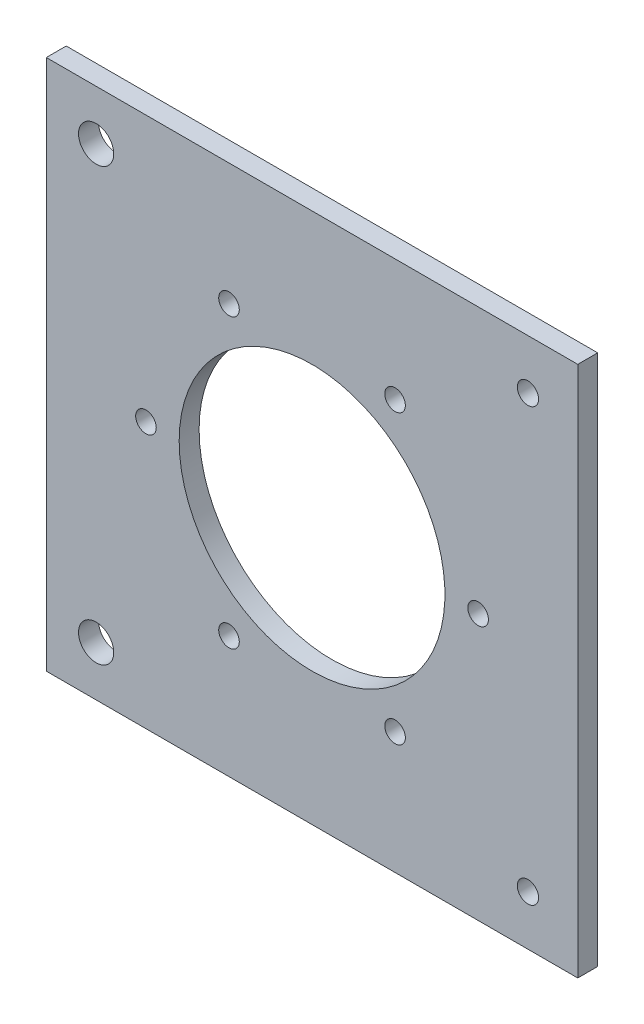
from build123d import *

# Parameters (mm, degrees)
SKETCH_1_W          = 80
SKETCH_1_H          = 80
SKETCH_1_R          = 2.65
SKETCH_1_R_2        = 1.6
SKETCH_1_R_3        = 18
EXTRUDE_1_DEPTH     = 4
SKETCH_2_R          = 1.55
CUT_EXTRUDE_1_DEPTH = 57.709787515
SKETCH_4_R          = 20
CUT_EXTRUDE_2_DEPTH = 57.709787515
SKETCH_5_W          = 141.692074253
SKETCH_5_H          = 118.011672495
CUT_EXTRUDE_3_DEPTH = 1


with BuildPart() as part:
    # 草图1 → 凸台-拉伸1 (new body)
    with BuildSketch(Plane.XY):
        Rectangle(SKETCH_1_W, SKETCH_1_H)
        with Locations((-32.5, 32.5)):
            Circle(SKETCH_1_R, mode=Mode.SUBTRACT)
        with Locations((-32.5, -32.5)):
            Circle(SKETCH_1_R, mode=Mode.SUBTRACT)
        with Locations((32.5, 32.5)):
            Circle(SKETCH_1_R_2, mode=Mode.SUBTRACT)
        with Locations((32.5, -32.5)):
            Circle(SKETCH_1_R_2, mode=Mode.SUBTRACT)
        Circle(SKETCH_1_R_3, mode=Mode.SUBTRACT)
    extrude(amount=EXTRUDE_1_DEPTH)

    # 草图2 → 切除-拉伸1 (cut, through all)
    with BuildSketch(Plane.XY.offset(4)):
        with Locations((-12.5, 21.650635095)):
            Circle(SKETCH_2_R)
        with Locations((12.5, 21.650635095)):
            Circle(SKETCH_2_R)
        with Locations((25, 0)):
            Circle(SKETCH_2_R)
        with Locations((12.5, -21.650635095)):
            Circle(SKETCH_2_R)
        with Locations((-12.5, -21.650635095)):
            Circle(SKETCH_2_R)
        with Locations((-25, 0)):
            Circle(SKETCH_2_R)
    extrude(amount=-CUT_EXTRUDE_1_DEPTH, mode=Mode.SUBTRACT)

    # 草图4 → 切除-拉伸2 (cut, through all)
    with BuildSketch(Plane(origin=(0, 0, 0), x_dir=(-1, 0, 0), z_dir=(0, 0, -1))):
        Circle(SKETCH_4_R)
    extrude(amount=-CUT_EXTRUDE_2_DEPTH, mode=Mode.SUBTRACT)

    # 草图5 → 切除-拉伸3 (cut)
    with BuildSketch(Plane(origin=(0, 0, 0), x_dir=(-1, 0, 0), z_dir=(0, 0, -1))):
        with Locations((12.88109766, -5.92010044)):
            Rectangle(SKETCH_5_W, SKETCH_5_H)
    extrude(amount=-CUT_EXTRUDE_3_DEPTH, mode=Mode.SUBTRACT)


solid = part.part
